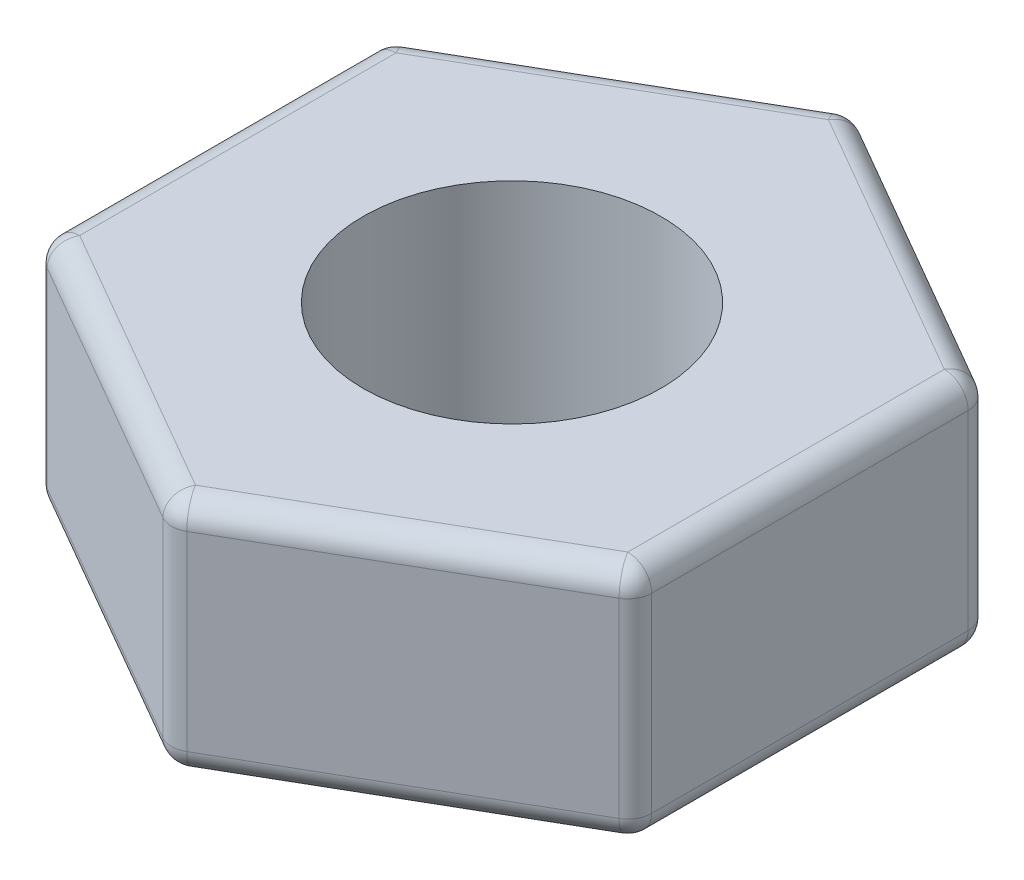
from build123d import *

# Parameters (mm, degrees)
SKETCH1_R           = 1.25
BOSS_EXTRUDE1_DEPTH = 2
FILLET1_R           = 0.2


with BuildPart() as part:
    # Sketch1 → Boss-Extrude1 (new body)
    with BuildSketch(Plane(origin=(0, 0, 0), x_dir=(1, 0, 0), z_dir=(0, 1, 0))):
        Polygon((0, -2.886751346), (2.5, -1.443375673), (2.5, 1.443375673), (0, 2.886751346), (-2.5, 1.443375673), (-2.5, -1.443375673), align=None)
        with Locations(Location((0, 0, 0), (0, 0, 270))):
            Circle(SKETCH1_R, mode=Mode.SUBTRACT)
    extrude(amount=BOSS_EXTRUDE1_DEPTH)

    # Fillet1
    fillet1_edges = [part.edges().sort_by_distance(p)[0] for p in [
        (-2.5, 1, 1.443375673),
        (-2.5, 1, -1.443375673),
        (0, 1, -2.886751346),
        (2.5, 1, -1.443375673),
        (2.5, 1, 1.443375673),
        (0, 1, 2.886751346),
        (2.5, 2, 0),
        (1.25, 2, -2.165063509),
        (-1.25, 2, -2.165063509),
        (-2.5, 2, 0),
        (-1.25, 2, 2.165063509),
        (-2.5, 0, 0),
        (-1.25, 0, -2.165063509),
        (1.25, 0, -2.165063509),
        (2.5, 0, 0),
        (1.25, 0, 2.165063509),
        (-1.25, 0, 2.165063509),
        (1.25, 2, 2.165063509),
    ]]
    fillet(fillet1_edges, radius=FILLET1_R)


solid = part.part
